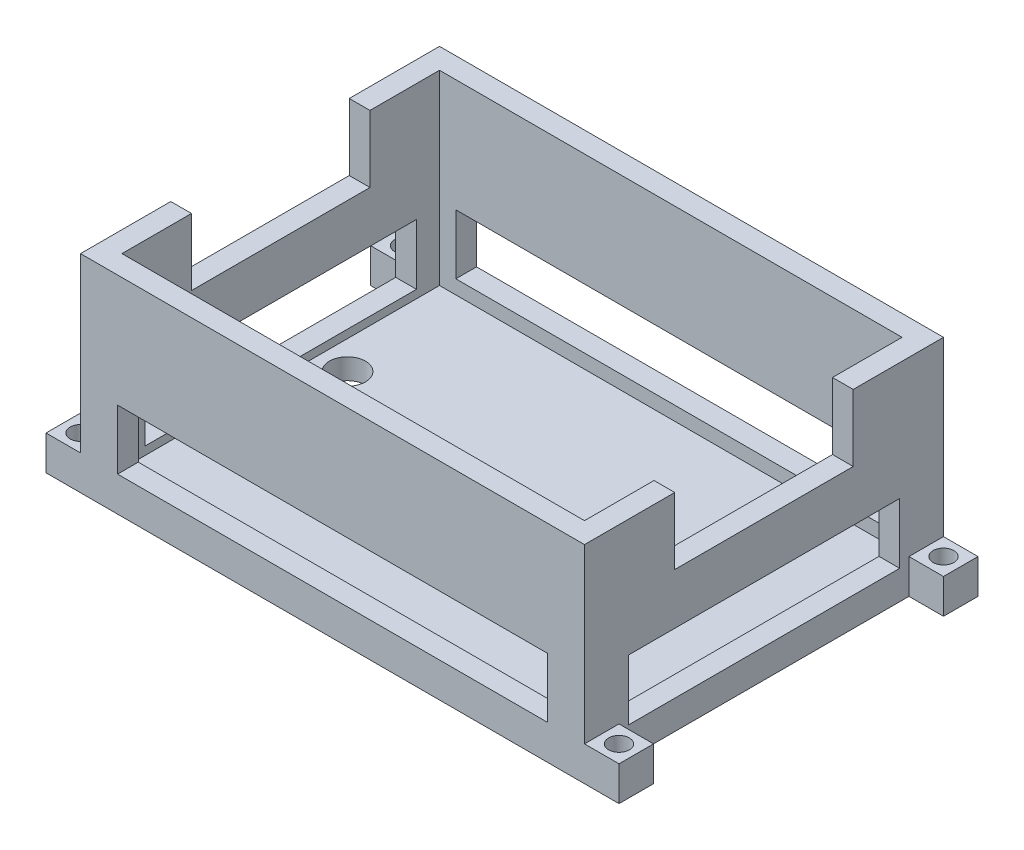
from build123d import *

# Parameters (mm, degrees)
SKETCH_1_W               = 73
SKETCH_1_H               = 52
SKETCH_1_W_2             = 67
SKETCH_1_H_2             = 46
EXTRUDE_1_DEPTH          = 30
SKETCH_1_2_W             = 67
SKETCH_1_2_H             = 46
EXTRUDE_2_DEPTH          = 3
CUT_EXTRUDE_1_DEPTH      = 69.067980725
CUT_EXTRUDE_1_DEPTH_BACK = 69.067980725
SKETCH_2_W               = 62.268542554
SKETCH_2_H               = 8.657438287
SKETCH_3_W               = 5
SKETCH_3_H               = 5
SKETCH_3_R               = 1.5
EXTRUDE_3_DEPTH          = 5
CUT_EXTRUDE_2_DEPTH      = 85.858706094
CUT_EXTRUDE_2_DEPTH_BACK = 85.858706094
SKETCH_4_W               = 39.317133882
SKETCH_4_H               = 8.764149171
CUT_EXTRUDE_3_DEPTH      = 88.521425948
CUT_EXTRUDE_3_DEPTH_BACK = 88.521425948
SKETCH_5_W               = 25.853493498
SKETCH_5_H               = 9.668476694
SKETCH_6_R               = 2.613718533
CUT_EXTRUDE_4_DEPTH      = 56.921820428


with BuildPart() as part:
    # 草图1 → 凸台-拉伸1 (new body)
    with BuildSketch(Plane(origin=(0, 0, 0), x_dir=(1, 0, 0), z_dir=(0, 1, 0))):
        Rectangle(SKETCH_1_W, SKETCH_1_H)
        Rectangle(SKETCH_1_W_2, SKETCH_1_H_2, mode=Mode.SUBTRACT)
    extrude(amount=EXTRUDE_1_DEPTH)

    # 草图1<2> → 凸台-拉伸2 (add)
    with BuildSketch(Plane(origin=(0, 0, 0), x_dir=(1, 0, 0), z_dir=(0, 1, 0))):
        Rectangle(SKETCH_1_2_W, SKETCH_1_2_H)
    extrude(amount=EXTRUDE_2_DEPTH)

    # 草图2 → 切除-拉伸1 (cut, two sides: drawn at the far end of the back side and taken through both)
    with BuildSketch(Plane.XY.offset(-23).offset(-CUT_EXTRUDE_1_DEPTH_BACK)):
        with Locations((0, 9.350523915)):
            Rectangle(SKETCH_2_W, SKETCH_2_H)
    extrude(amount=CUT_EXTRUDE_1_DEPTH + CUT_EXTRUDE_1_DEPTH_BACK, mode=Mode.SUBTRACT)

    # 草图3 → 凸台-拉伸3 (add)
    # profile 1 of 4: a face of its own
    with BuildSketch(Plane(origin=(0, 0, 0), x_dir=(1, 0, 0), z_dir=(0, 1, 0))):
        with Locations((39, 23.5)):
            Rectangle(SKETCH_3_W, SKETCH_3_H)
        with Locations((39, 23.5)):
            Circle(SKETCH_3_R, mode=Mode.SUBTRACT)
    # profile 2 of 4: a face of its own
    with BuildSketch(Plane(origin=(0, 0, 0), x_dir=(1, 0, 0), z_dir=(0, 1, 0))):
        with Locations((39, -23.5)):
            Rectangle(SKETCH_3_W, SKETCH_3_H)
        with Locations((39, -23.5)):
            Circle(SKETCH_3_R, mode=Mode.SUBTRACT)
    # profile 3 of 4: a face of its own
    with BuildSketch(Plane(origin=(0, 0, 0), x_dir=(1, 0, 0), z_dir=(0, 1, 0))):
        with Locations((-39, -23.5)):
            Rectangle(SKETCH_3_W, SKETCH_3_H)
        with Locations((-39, -23.5)):
            Circle(SKETCH_3_R, mode=Mode.SUBTRACT)
    # profile 4 of 4: a face of its own
    with BuildSketch(Plane(origin=(0, 0, 0), x_dir=(1, 0, 0), z_dir=(0, 1, 0))):
        with Locations((-39, 23.5)):
            Rectangle(SKETCH_3_W, SKETCH_3_H)
        with Locations((-39, 23.5)):
            Circle(SKETCH_3_R, mode=Mode.SUBTRACT)
    extrude(amount=EXTRUDE_3_DEPTH)

    # 草图4 → 切除-拉伸2 (cut, two sides: drawn at the far end of the back side and taken through both)
    with BuildSketch(Plane.ZY.offset(-33.5).offset(-CUT_EXTRUDE_2_DEPTH_BACK)):
        with Locations((0, 8.573599651)):
            Rectangle(SKETCH_4_W, SKETCH_4_H)
    extrude(amount=CUT_EXTRUDE_2_DEPTH + CUT_EXTRUDE_2_DEPTH_BACK, mode=Mode.SUBTRACT)

    # 草图5 → 切除-拉伸3 (cut, two sides: drawn at the far end of the back side and taken through both)
    with BuildSketch(Plane(origin=(36.5, 0, 0), x_dir=(0, 0, -1), z_dir=(1, 0, 0)).offset(-CUT_EXTRUDE_3_DEPTH_BACK)):
        with Locations((0, 25.165761653)):
            Rectangle(SKETCH_5_W, SKETCH_5_H)
    extrude(amount=CUT_EXTRUDE_3_DEPTH + CUT_EXTRUDE_3_DEPTH_BACK, mode=Mode.SUBTRACT)

    # 草图6 → 切除-拉伸4 (cut, through all)
    with BuildSketch(Plane(origin=(0, 3, 0), x_dir=(1, 0, 0), z_dir=(0, 1, 0))):
        with Locations((-29.37891044, 5.538923259)):
            Circle(SKETCH_6_R)
    extrude(amount=-CUT_EXTRUDE_4_DEPTH, mode=Mode.SUBTRACT)


solid = part.part
